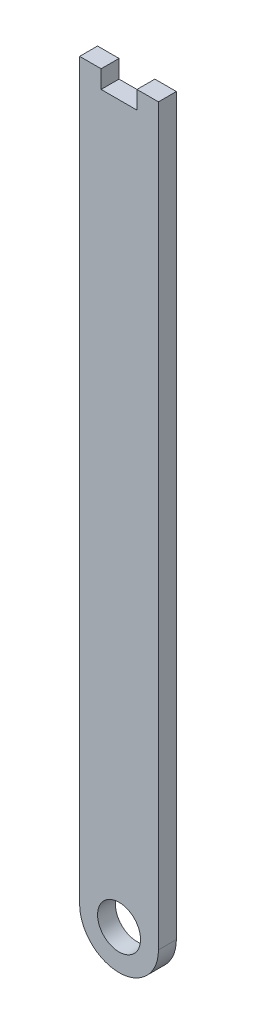
from build123d import *

# Parameters (mm, degrees)
SKETCH1_R           = 6
BOSS_EXTRUDE1_DEPTH = 2.5


with BuildPart() as part:
    # Sketch1 → Boss-Extrude1 (new, symmetric)
    with BuildSketch(Plane(origin=(0, 0, 0), x_dir=(0, 1, 0), z_dir=(0, 0, 1))):
        with BuildLine():
            Line((0, 11), (205, 11))
            Line((205, 11), (205, 5))
            Line((205, 5), (200, 5))
            Line((200, 5), (200, -5))
            Line((200, -5), (205, -5))
            Line((205, -5), (205, -11))
            Line((205, -11), (0, -11))
            ThreePointArc((0, -11), (-11, 0), (0, 11))
        make_face()
        with Locations(Location((0, 0, 0), (0, 0, 270))):
            Circle(SKETCH1_R, mode=Mode.SUBTRACT)
    extrude(amount=BOSS_EXTRUDE1_DEPTH, both=True)


solid = part.part
